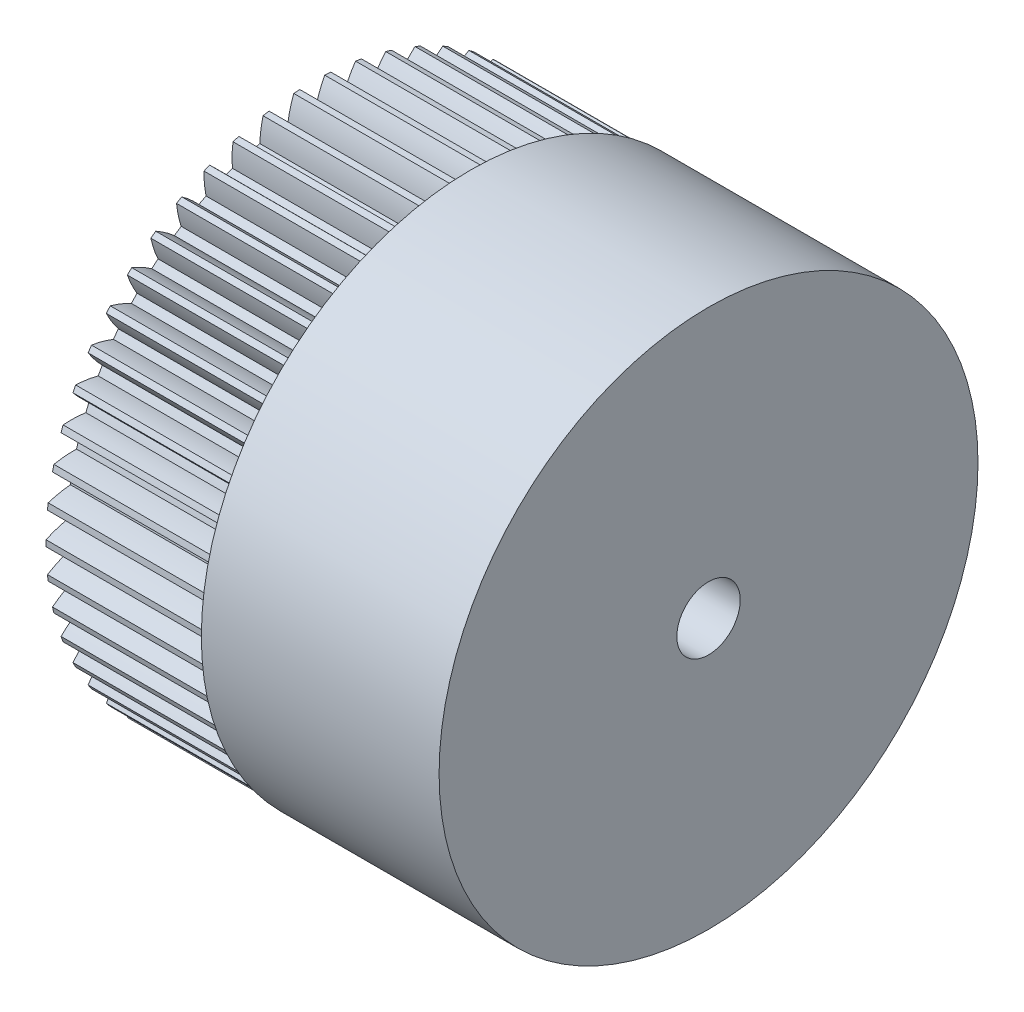
from build123d import *

# Parameters (mm, degrees)
BASPROSKE_W         = 10
BASPROSKE_H         = 16.8
TOOTHCUT_DEPTH      = 26.777509577
TEETHCUTS_COUNT     = 54
TEETHCUTS_ANGLE     = 353.333333333
BORSKE_R            = 2
BORE_DEPTH          = 50.0008636
BOSS_EXTRUDE1_START = 15
SKETCH1_R           = 17
SKETCH1_R_2         = 2
BOSS_EXTRUDE1_DEPTH = 15


with BuildPart() as part:
    # BasProSke → Base-Revolve (revolve)
    with BuildSketch(Plane(origin=(0, 0, 0), x_dir=(1, 0, 0), z_dir=(0, 1, 0)), mode=Mode.PRIVATE) as base_revolve_sk:
        with Locations((5, 8.4)):
            Rectangle(BASPROSKE_W, BASPROSKE_H)
    revolve(base_revolve_sk.sketch.rotate(Axis((-10, 0, 0), (1, 0, 0)), 180), axis=Axis((-10, 0, 0), (1, 0, 0)))

    # TooCutSke → ToothCut (cut, through all)
    with BuildSketch(Plane(origin=(0, 0, 0), x_dir=(0, 0, -1), z_dir=(1, 0, 0))):
        with BuildLine():
            ThreePointArc((0.260831852, 15.446797977), (0, 15.449), (-0.260831852, 15.446797977))
            ThreePointArc((-0.260831852, 15.446797977), (-0.491357596, 16.141835381), (-0.798828381, 16.806426104))
            ThreePointArc((-0.798828381, 16.806426104), (0, 16.8254), (0.798828381, 16.806426104))
            ThreePointArc((0.798828381, 16.806426104), (0.491357596, 16.141835381), (0.260831852, 15.446797977))
        make_face()
    toothcut = extrude(amount=TOOTHCUT_DEPTH, mode=Mode.SUBTRACT)

    # TeethCuts: ToothCut ×54 about axis
    teethcuts_axis = Axis((-10, 0, 0), (1, 0, 0))
    for i in range(1, TEETHCUTS_COUNT):
        add(toothcut.rotate(teethcuts_axis, i * TEETHCUTS_ANGLE / (TEETHCUTS_COUNT - 1)), mode=Mode.SUBTRACT)

    # BorSke → Bore (cut, symmetric)
    with BuildSketch(Plane(origin=(0, 0, 0), x_dir=(0, 0, -1), z_dir=(1, 0, 0))):
        with Locations(Location((0, 0, 0), (0, 0, 180))):
            Circle(BORSKE_R)
    extrude(amount=BORE_DEPTH, both=True, mode=Mode.SUBTRACT)

    # Sketch1 → Boss-Extrude1 (add)
    with BuildSketch(Plane(origin=(10, 0, 0), x_dir=(0, 0, -1), z_dir=(1, 0, 0)).offset(BOSS_EXTRUDE1_START)):
        Circle(SKETCH1_R)
        Circle(SKETCH1_R_2, mode=Mode.SUBTRACT)
    extrude(amount=-BOSS_EXTRUDE1_DEPTH)


solid = part.part
